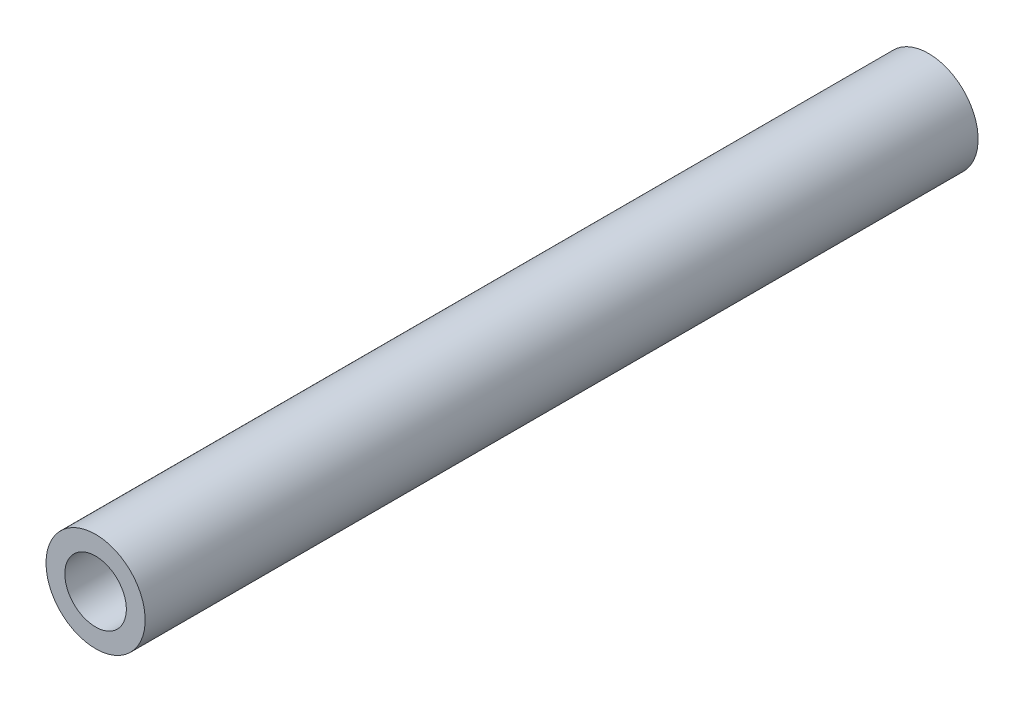
from build123d import *

# Parameters (mm, degrees)
SKETCH_1_R      = 2.5
SKETCH_1_R_2    = 1.55
EXTRUDE_1_DEPTH = 42


with BuildPart() as part:
    # 草图1 → 凸台-拉伸1 (new body)
    with BuildSketch(Plane.XY):
        with Locations(Location((0, 0, 0), (0, 0, 180))):
            Circle(SKETCH_1_R)
        with Locations(Location((0, 0, 0), (0, 0, 180))):
            Circle(SKETCH_1_R_2, mode=Mode.SUBTRACT)
    extrude(amount=EXTRUDE_1_DEPTH)


solid = part.part
